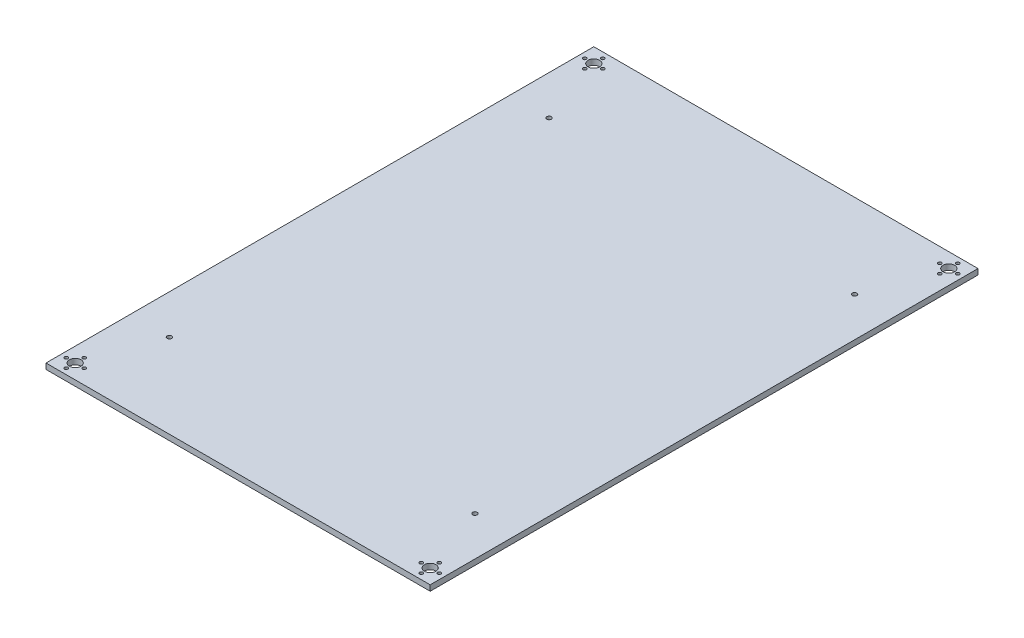
from build123d import *

# Parameters (mm, degrees)
SKETCH1_W                             = 487.65
SKETCH1_H                             = 5
BOSS_EXTRUDE1_DEPTH                   = 342
THREADEDROD_HOLES_SKETCH2_R           = 5.1
THREADEDROD_HOLES_SKETCH2_R_2         = 1.5
THREADEDRODHOLES_CUT_EXTRUDE1_DEPTH   = 596.643788266
BASEOLATEMOUNTHOLESSKETCH2_R          = 2
BASEPLATEMOUNTHOLESCUT_EXTRUDE1_DEPTH = 596.643788266


with BuildPart() as part:
    # Sketch1 → Boss-Extrude1 (new body)
    with BuildSketch(Plane(origin=(0, 0, 0), x_dir=(0, 0, -1), z_dir=(1, 0, 0))):
        with Locations((-243.825, 2.5)):
            Rectangle(SKETCH1_W, SKETCH1_H)
    extrude(amount=BOSS_EXTRUDE1_DEPTH)

    # ThreadedRod'Holes-Sketch2 → ThreadedRodHoles-Cut-Extrude1 (cut, through all)
    with BuildSketch(Plane(origin=(0, 5, 0), x_dir=(1, 0, 0), z_dir=(0, 1, 0))):
        with Locations(Location((329, -13, 0), (0, 0, 270))):
            Circle(THREADEDROD_HOLES_SKETCH2_R)
        with Locations(Location((321, -13, 0), (0, 0, 270))):
            Circle(THREADEDROD_HOLES_SKETCH2_R_2)
        with Locations(Location((329, -5, 0), (0, 0, 270))):
            Circle(THREADEDROD_HOLES_SKETCH2_R_2)
        with Locations(Location((329, -21, 0), (0, 0, 270))):
            Circle(THREADEDROD_HOLES_SKETCH2_R_2)
        with Locations(Location((337, -13, 0), (0, 0, 270))):
            Circle(THREADEDROD_HOLES_SKETCH2_R_2)
        with Locations(Location((21, -13, 0), (0, 0, 270))):
            Circle(THREADEDROD_HOLES_SKETCH2_R_2)
        with Locations(Location((13, -21, 0), (0, 0, 270))):
            Circle(THREADEDROD_HOLES_SKETCH2_R_2)
        with Locations(Location((13, -5, 0), (0, 0, 270))):
            Circle(THREADEDROD_HOLES_SKETCH2_R_2)
        with Locations(Location((5, -13, 0), (0, 0, 270))):
            Circle(THREADEDROD_HOLES_SKETCH2_R_2)
        with Locations(Location((13, -13, 0), (0, 0, 270))):
            Circle(THREADEDROD_HOLES_SKETCH2_R)
        with Locations(Location((13, -482.65, 0), (0, 0, 270))):
            Circle(THREADEDROD_HOLES_SKETCH2_R_2)
        with Locations(Location((21, -474.65, 0), (0, 0, 270))):
            Circle(THREADEDROD_HOLES_SKETCH2_R_2)
        with Locations(Location((5, -474.65, 0), (0, 0, 270))):
            Circle(THREADEDROD_HOLES_SKETCH2_R_2)
        with Locations(Location((13, -466.65, 0), (0, 0, 270))):
            Circle(THREADEDROD_HOLES_SKETCH2_R_2)
        with Locations(Location((321, -474.65, 0), (0, 0, 270))):
            Circle(THREADEDROD_HOLES_SKETCH2_R_2)
        with Locations(Location((329, -482.65, 0), (0, 0, 270))):
            Circle(THREADEDROD_HOLES_SKETCH2_R_2)
        with Locations(Location((329, -466.65, 0), (0, 0, 270))):
            Circle(THREADEDROD_HOLES_SKETCH2_R_2)
        with Locations(Location((337, -474.65, 0), (0, 0, 270))):
            Circle(THREADEDROD_HOLES_SKETCH2_R_2)
        with Locations(Location((13, -474.65, 0), (0, 0, 270))):
            Circle(THREADEDROD_HOLES_SKETCH2_R)
        with Locations(Location((329, -474.65, 0), (0, 0, 270))):
            Circle(THREADEDROD_HOLES_SKETCH2_R)
    extrude(amount=-THREADEDRODHOLES_CUT_EXTRUDE1_DEPTH, mode=Mode.SUBTRACT)

    # BaseOlateMountHolesSketch2 → BasePlateMountHolesCut-Extrude1 (cut, through all)
    with BuildSketch(Plane(origin=(0, 5, 0), x_dir=(1, 0, 0), z_dir=(0, 1, 0))):
        with Locations(Location((35, -74.825, 0), (0, 0, 270))):
            Circle(BASEOLATEMOUNTHOLESSKETCH2_R)
        with Locations(Location((307, -74.825, 0), (0, 0, 270))):
            Circle(BASEOLATEMOUNTHOLESSKETCH2_R)
        with Locations(Location((307, -412.825, 0), (0, 0, 270))):
            Circle(BASEOLATEMOUNTHOLESSKETCH2_R)
        with Locations(Location((35, -412.825, 0), (0, 0, 270))):
            Circle(BASEOLATEMOUNTHOLESSKETCH2_R)
    extrude(amount=-BASEPLATEMOUNTHOLESCUT_EXTRUDE1_DEPTH, mode=Mode.SUBTRACT)


solid = part.part
